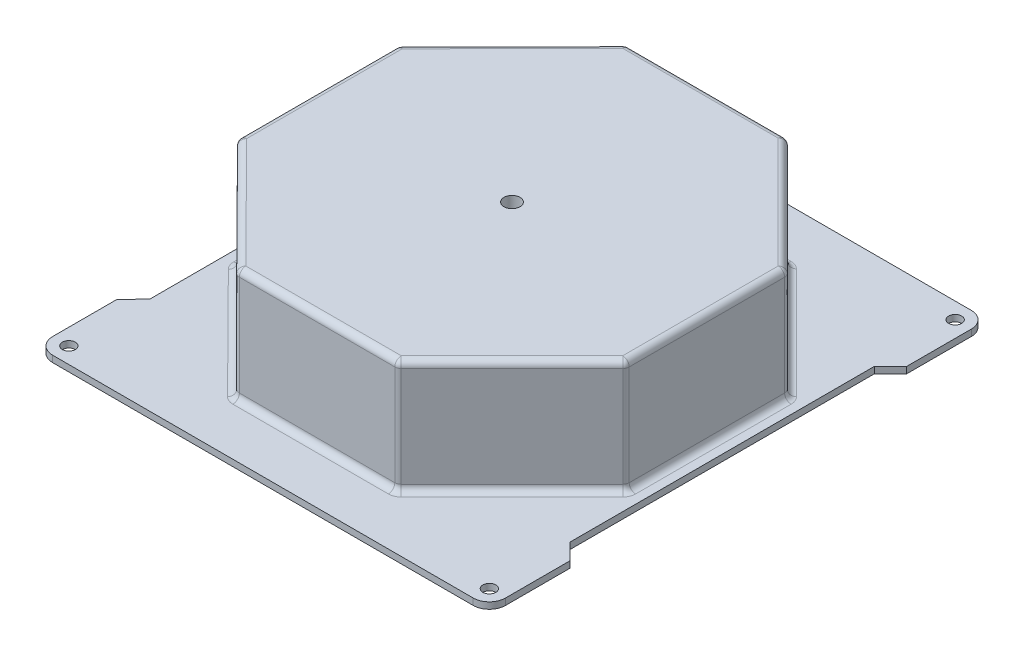
from build123d import *

# Parameters (mm, degrees)
SKETCH1_R           = 2
BOSS_EXTRUDE1_DEPTH = 2
SKETCH2_R           = 2.5
BOSS_EXTRUDE2_DEPTH = 35
FILLET1_R           = 2


with BuildPart() as part:
    # Sketch1 → Boss-Extrude1 (new body)
    with BuildSketch(Plane(origin=(0, 0, 0), x_dir=(1, 0, 0), z_dir=(0, 1, 0))):
        with BuildLine():
            Line((-65, 47), (-65, -47))
            Line((-65, -47), (-70, -52.103103631))
            Line((-70, -52.103103631), (-70, -72))
            ThreePointArc((-70, -72), (-68.535533906, -75.535533906), (-65, -77))
            Line((-65, -77), (65, -77))
            ThreePointArc((65, -77), (68.535533906, -75.535533906), (70, -72))
            Line((70, -72), (70, -52.103103631))
            Line((70, -52.103103631), (65, -47))
            Line((65, -47), (65, 47))
            Line((65, 47), (70, 51.898979486))
            Line((70, 51.898979486), (70, 72))
            ThreePointArc((70, 72), (68.535533906, 75.535533906), (65, 77))
            Line((65, 77), (-65, 77))
            ThreePointArc((-65, 77), (-68.535533906, 75.535533906), (-70, 72))
            Line((-70, 72), (-70, 51.898979486))
            Line((-70, 51.898979486), (-65, 47))
        make_face()
        with Locations(Location((-65, -72, 0), (0, 0, 270))):
            Circle(SKETCH1_R, mode=Mode.SUBTRACT)
        with Locations(Location((65, -72, 0), (0, 0, 270))):
            Circle(SKETCH1_R, mode=Mode.SUBTRACT)
        with Locations(Location((-65, 72, 0), (0, 0, 270))):
            Circle(SKETCH1_R, mode=Mode.SUBTRACT)
        with Locations(Location((65, 72, 0), (0, 0, 270))):
            Circle(SKETCH1_R, mode=Mode.SUBTRACT)
    extrude(amount=BOSS_EXTRUDE1_DEPTH)

    # Sketch2 → Boss-Extrude2 (add)
    with BuildSketch(Plane(origin=(0, 2, 0), x_dir=(1, 0, 0), z_dir=(0, 1, 0))):
        Polygon((-60, -24.852813742), (-24.852813742, -60.262270904), (24.852813742, -60.262270904), (60.262270904, -24.852813742), (60.262270904, 24.852813742), (24.852813742, 60.262270904), (-24.852813742, 60.262270904), (-60, 24.852813742), align=None)
        with Locations(Location((0, 0, 0), (0, 0, 270))):
            Circle(SKETCH2_R, mode=Mode.SUBTRACT)
    extrude(amount=BOSS_EXTRUDE2_DEPTH)

    # Fillet1
    fillet1_edges = [part.edges().sort_by_distance(p)[0] for p in [
        (-42.426406871, 37, -42.557542323),
        (-60, 37, 0),
        (-42.426406871, 37, 42.557542323),
        (0, 37, 60.262270904),
        (42.557542323, 37, 42.557542323),
        (60.262270904, 37, 0),
        (42.557542323, 37, -42.557542323),
        (0, 37, -60.262270904),
        (-42.426406871, 2, -42.557542323),
        (-24.852813742, 19.5, -60.262270904),
        (-60, 2, 0),
        (-60, 19.5, -24.852813742),
        (-42.426406871, 2, 42.557542323),
        (-60, 19.5, 24.852813742),
        (0, 2, 60.262270904),
        (-24.852813742, 19.5, 60.262270904),
        (42.557542323, 2, 42.557542323),
        (24.852813742, 19.5, 60.262270904),
        (60.262270904, 2, 0),
        (60.262270904, 19.5, 24.852813742),
        (42.557542323, 2, -42.557542323),
        (60.262270904, 19.5, -24.852813742),
        (0, 2, -60.262270904),
        (24.852813742, 19.5, -60.262270904),
    ]]
    fillet(fillet1_edges, radius=FILLET1_R)


solid = part.part
